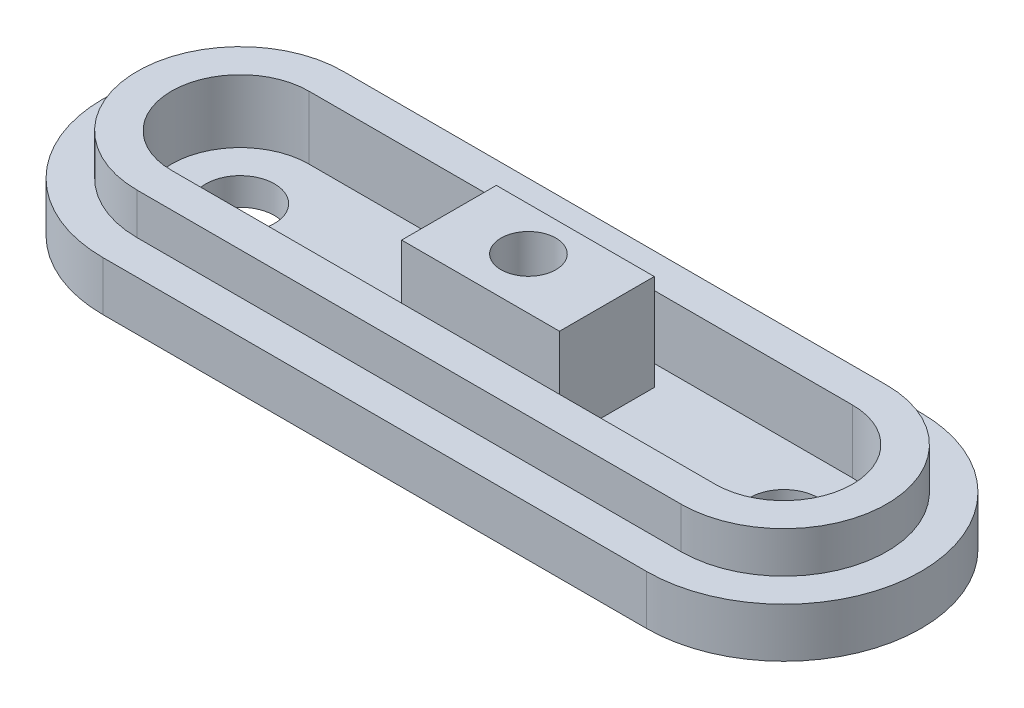
from build123d import *

# Parameters (mm, degrees)
SALIENTE_EXTRUIR1_DEPTH = 18
SALIENTE_EXTRUIR6_START = -36
SALIENTE_EXTRUIR6_DEPTH = 66
CORTAR_EXTRUIR1_START   = 48
CORTAR_EXTRUIR1_DEPTH   = 46
CORTAR_EXTRUIR2_START   = 18
CROQUIS4_R              = 25
CORTAR_EXTRUIR2_DEPTH   = 340.524582953
CROQUIS5_W              = 115
CROQUIS5_H              = 90
SALIENTE_EXTRUIR7_DEPTH = 34.5
CORTAR_EXTRUIR3_START   = 72
CROQUIS7_R              = 20
CORTAR_EXTRUIR3_DEPTH   = 398.972479579


with BuildPart() as part:
    # Croquis1 → Saliente-Extruir1 (new, symmetric)
    with BuildSketch(Plane(origin=(0, 0, 0), x_dir=(1, 0, 0), z_dir=(0, 1, 0))):
        with BuildLine():
            Line((-194.323843522, -100.327234865), (201.676156478, -100.327234865))
            ThreePointArc((201.676156478, -100.327234865), (301.676156478, -0.327234865), (201.676156478, 99.672765135))
            Line((201.676156478, 99.672765135), (-194.323843522, 99.672765135))
            ThreePointArc((-194.323843522, 99.672765135), (-294.323843522, -0.327234865), (-194.323843522, -100.327234865))
        make_face()
    extrude(amount=SALIENTE_EXTRUIR1_DEPTH, both=True)

    # Croquis2 → Saliente-Extruir6 (add)
    with BuildSketch(Plane(origin=(0, 18, 0), x_dir=(1, 0, 0), z_dir=(0, 1, 0)).offset(SALIENTE_EXTRUIR6_START)):
        with BuildLine():
            Line((-194.323843522, -75.327234865), (201.676156478, -75.327234865))
            ThreePointArc((201.676156478, -75.327234865), (276.676156478, -0.327234865), (201.676156478, 74.672765135))
            Line((201.676156478, 74.672765135), (-194.323843522, 74.672765135))
            ThreePointArc((-194.323843522, 74.672765135), (-269.323843522, -0.327234865), (-194.323843522, -75.327234865))
        make_face()
    extrude(amount=SALIENTE_EXTRUIR6_DEPTH)

    # Croquis3 → Cortar-Extruir1 (cut)
    with BuildSketch(Plane(origin=(0, 0, 0), x_dir=(1, 0, 0), z_dir=(0, 1, 0)).offset(CORTAR_EXTRUIR1_START)):
        with BuildLine():
            Line((-194.323843522, -50.327234865), (201.676156478, -50.327234865))
            ThreePointArc((201.676156478, -50.327234865), (251.676156478, -0.327234865), (201.676156478, 49.672765135))
            Line((201.676156478, 49.672765135), (-194.323843522, 49.672765135))
            ThreePointArc((-194.323843522, 49.672765135), (-244.323843522, -0.327234865), (-194.323843522, -50.327234865))
        make_face()
    extrude(amount=-CORTAR_EXTRUIR1_DEPTH, mode=Mode.SUBTRACT)

    # Croquis4 → Cortar-Extruir2 (cut, through all)
    with BuildSketch(Plane(origin=(0, 0, 0), x_dir=(1, 0, 0), z_dir=(0, 1, 0)).offset(CORTAR_EXTRUIR2_START)):
        with Locations(Location((-194.323843522, -0.327234865, 0), (0, 0, 90))):
            Circle(CROQUIS4_R)
        with Locations(Location((201.676156478, -0.327234865, 0), (0, 0, 90))):
            Circle(CROQUIS4_R)
    extrude(amount=-CORTAR_EXTRUIR2_DEPTH, mode=Mode.SUBTRACT)

    # Croquis5 → Saliente-Extruir7 (add, symmetric)
    with BuildSketch(Plane.XY):
        with Locations((14.961556785, 27)):
            Rectangle(CROQUIS5_W, CROQUIS5_H)
    extrude(amount=SALIENTE_EXTRUIR7_DEPTH, both=True)

    # Croquis7 → Cortar-Extruir3 (cut, through all)
    with BuildSketch(Plane(origin=(0, 0, 0), x_dir=(1, 0, 0), z_dir=(0, 1, 0)).offset(CORTAR_EXTRUIR3_START)):
        with Locations(Location((12.367095305, 2.963956449, 0), (0, 0, 270))):
            Circle(CROQUIS7_R)
    extrude(amount=-CORTAR_EXTRUIR3_DEPTH, mode=Mode.SUBTRACT)


solid = part.part
